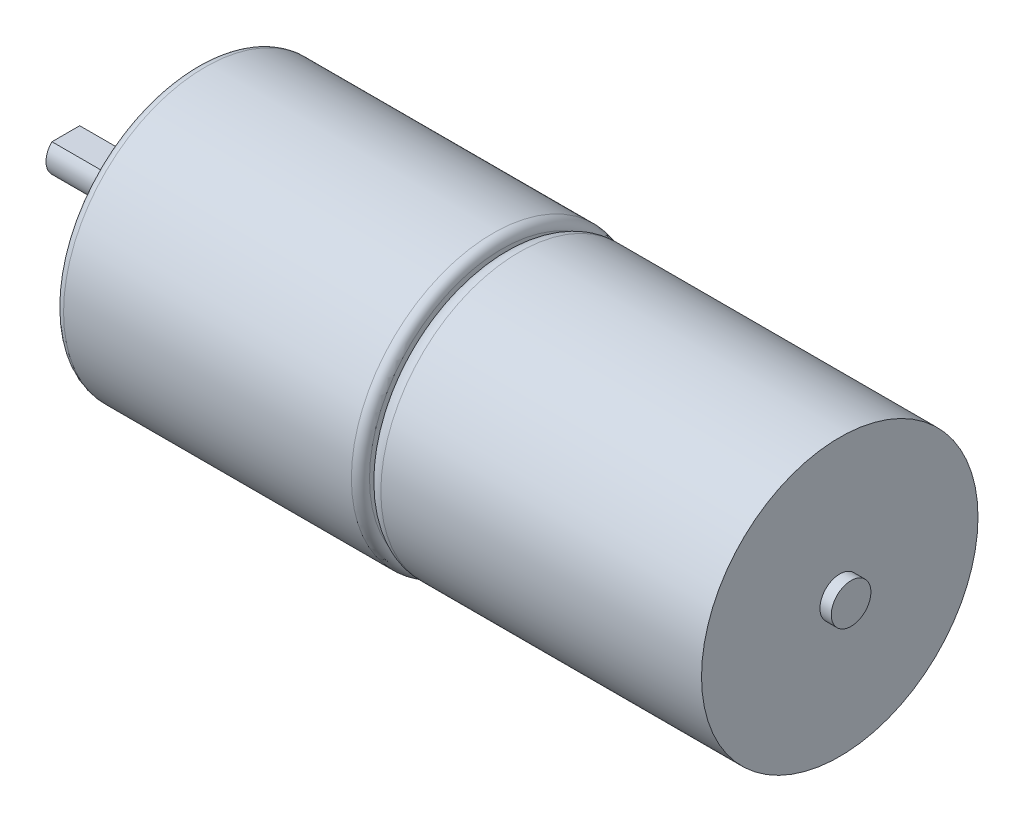
from build123d import *

# Parameters (mm, degrees)
CROQUIS3_W            = 2.449489742
CROQUIS3_H            = 1
CORTAR_EXTRUIR1_DEPTH = 5
CROQUIS4_R            = 1.5
CORTAR_EXTRUIR2_DEPTH = 2
CROQUIS6_R            = 2.6
CORTAR_EXTRUIR3_DEPTH = 0.7
CORTAR_EXTRUIR4_DEPTH = 0.5


with BuildPart() as part:
    # Croquis1 → Revolución1 (revolve)
    with BuildSketch(Plane.XY, mode=Mode.PRIVATE) as revoluci_n1_sk:
        with BuildLine():
            Line((0, 0), (0, 1.75))
            Line((0, 1.75), (-1, 1.75))
            Line((-1, 1.75), (-1, 12.2))
            Line((-1, 12.2), (-29.3, 12.2))
            ThreePointArc((-29.3, 12.2), (-30.360660172, 11.760660172), (-30.8, 10.7))
            Line((-30.8, 10.7), (-30.8, 0))
            Line((-30.8, 0), (0, 0))
        make_face()
    revolve(revoluci_n1_sk.sketch.rotate(Axis((-226.683028939, 0, 0), (1, 0, 0)), 90), axis=Axis((-226.683028939, 0, 0), (1, 0, 0)))

    # Croquis2 → Revolución2 (revolve)
    with BuildSketch(Plane.XY, mode=Mode.PRIVATE) as revoluci_n2_sk:
        with BuildLine():
            Line((-57, 12.5), (-31.6, 12.5))
            ThreePointArc((-31.6, 12.5), (-31.034314575, 12.265685425), (-30.8, 11.7))
            Line((-30.8, 11.7), (-30.8, 0))
            Line((-30.8, 0), (-69.3, 0))
            Line((-69.3, 0), (-69.3, 1.75))
            Line((-69.3, 1.75), (-60.3, 1.75))
            Line((-60.3, 1.75), (-60.3, 3.5))
            Line((-60.3, 3.5), (-57.8, 3.5))
            Line((-57.8, 3.5), (-57.8, 11.7))
            ThreePointArc((-57.8, 11.7), (-57.565685425, 12.265685425), (-57, 12.5))
        make_face()
    revolve(revoluci_n2_sk.sketch.rotate(Axis((-1000, 0, 0), (1, 0, 0)), 90), axis=Axis((-1000, 0, 0), (1, 0, 0)))

    # Croquis3 → Cortar-Extruir1 (cut)
    with BuildSketch(Plane.ZY.offset(69.3)):
        with Locations((0, 1.75)):
            Rectangle(CROQUIS3_W, CROQUIS3_H)
    extrude(amount=-CORTAR_EXTRUIR1_DEPTH, mode=Mode.SUBTRACT)

    # Croquis4 → Cortar-Extruir2 (cut)
    with BuildSketch(Plane.ZY.offset(57.8)):
        with Locations((-8.5, 0)):
            Circle(CROQUIS4_R)
        with Locations((8.5, 0)):
            Circle(CROQUIS4_R)
    extrude(amount=-CORTAR_EXTRUIR2_DEPTH, mode=Mode.SUBTRACT)

    # Croquis6 → Cortar-Extruir3 (cut)
    with BuildSketch(Plane.ZY.offset(57.8)):
        with Locations((0, 8)):
            Circle(CROQUIS6_R)
        with Locations(Location((0, -8, 0), (0, 0, 180))):
            Circle(CROQUIS6_R)
    extrude(amount=-CORTAR_EXTRUIR3_DEPTH, mode=Mode.SUBTRACT)

    # Croquis7 → Cortar-Extruir4 (cut)
    with BuildSketch(Plane.ZY.offset(57.1)):
        Polygon((0.2, 9.9), (-0.2, 9.9), (-0.2, 8.2), (-1.9, 8.2), (-1.9, 7.8), (-0.2, 7.8), (-0.2, 6.1), (0.2, 6.1), (0.2, 7.8), (1.9, 7.8), (1.9, 8.2), (0.2, 8.2), align=None)
        Polygon((-0.2, -7.8), (-1.9, -7.8), (-1.9, -8.2), (-0.2, -8.2), (-0.2, -9.9), (0.2, -9.9), (0.2, -8.2), (1.9, -8.2), (1.9, -7.8), (0.2, -7.8), (0.2, -6.1), (-0.2, -6.1), align=None)
    extrude(amount=-CORTAR_EXTRUIR4_DEPTH, mode=Mode.SUBTRACT)


solid = part.part
